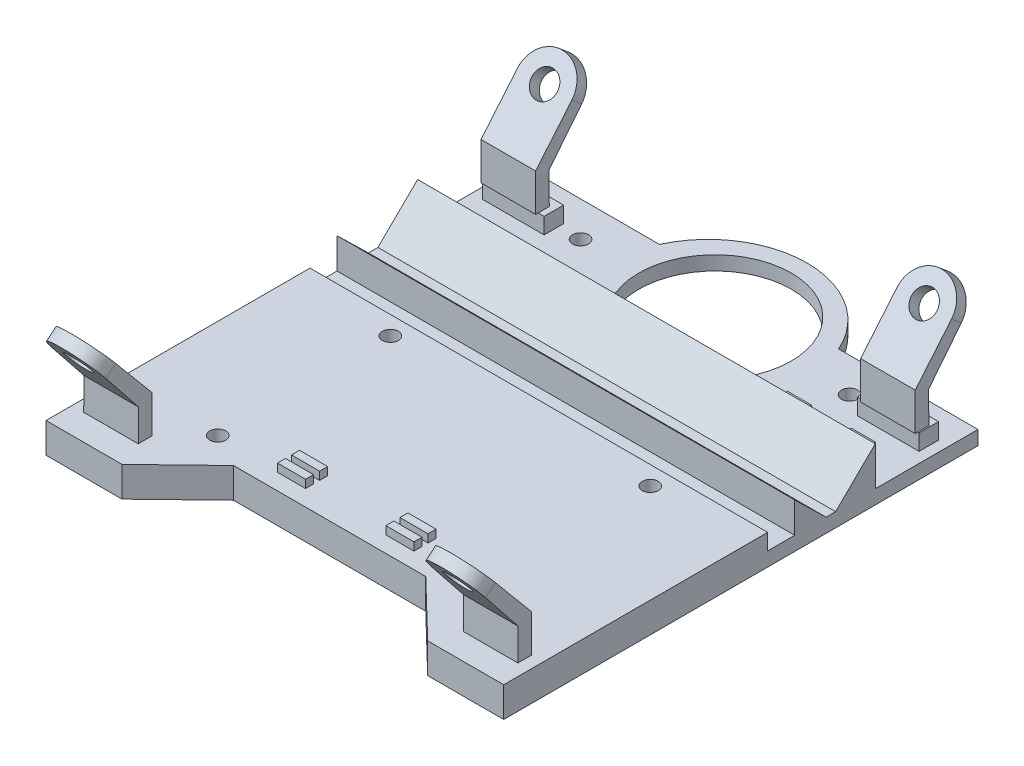
from build123d import *

# Parameters (mm, degrees)
SKIZZE1_W                        = 57
SKIZZE1_H                        = 60
AUFSATZ_LINEAR_AUSTRAGEN1_DEPTH  = 1.75
SKIZZE3_R                        = 9.495370676
SCHNITT_LINEAR_AUSTRAGEN1_DEPTH  = 2
SKIZZE4_W                        = 57
SKIZZE4_H                        = 26.054547174
AUFSATZ_LINEAR_AUSTRAGEN2_DEPTH  = 2
SKIZZE5_R                        = 1
SCHNITT_LINEAR_AUSTRAGEN2_DEPTH  = 4
AUFSATZ_LINEAR_AUSTRAGEN3_DEPTH  = 57
SKIZZE10_R                       = 1
SCHNITT_LINEAR_AUSTRAGEN3_DEPTH  = 2
AUFSATZ_LINEAR_AUSTRAGEN4_DEPTH  = 57
SKIZZE13_W                       = 3
SKIZZE13_H                       = 1
AUFSATZ_LINEAR_AUSTRAGEN6_DEPTH  = 1
SKIZZE16_W                       = 3.5
SKIZZE16_H                       = 1
AUFSATZ_LINEAR_AUSTRAGEN9_DEPTH  = 1
AUFSATZ_LINEAR_AUSTRAGEN11_DEPTH = 3.75
SKIZZE25_W                       = 6.8
SKIZZE25_H                       = 4.678014598
AUFSATZ_LINEAR_AUSTRAGEN12_DEPTH = 13
SKIZZE26_W                       = 6.272143652
SKIZZE26_H                       = 7.131924913
AUFSATZ_LINEAR_AUSTRAGEN13_DEPTH = 6.8
SCHNITT_LINEAR_AUSTRAGEN5_DEPTH  = 6.8
SCHNITT_LINEAR_AUSTRAGEN6_DEPTH  = 6.8
SCHNITT_LINEAR_AUSTRAGEN8_DEPTH  = 3.8
SKIZZE30_R                       = 1.6
SCHNITT_LINEAR_AUSTRAGEN9_DEPTH  = 3.8
SKIZZE31_W                       = 7.69751232
SKIZZE31_H                       = 2.429513609
AUFSATZ_LINEAR_AUSTRAGEN15_DEPTH = 2
SPIEGELN9_COPY_1_SKETCH_W        = 6.8
SPIEGELN9_COPY_1_SKETCH_H        = 4.678014598
SPIEGELN9_COPY_1_DEPTH           = 13
SPIEGELN9_COPY_2_SKETCH_W        = 6.272143652
SPIEGELN9_COPY_2_SKETCH_H        = 7.131924913
SPIEGELN9_COPY_2_DEPTH           = 6.8
SPIEGELN9_COPY_3_DEPTH           = 6.8
SPIEGELN9_COPY_4_DEPTH           = 6.8
SPIEGELN9_COPY_5_DEPTH           = 3.8
SPIEGELN9_COPY_6_SKETCH_R        = 1.6
SPIEGELN9_COPY_6_DEPTH           = 3.8
SCHNITT_LINEAR_AUSTRAGEN10_DEPTH = 10
SCHNITT_LINEAR_AUSTRAGEN11_DEPTH = 10


with BuildPart() as part:
    # Skizze1 → Aufsatz-Linear austragen1 (new body)
    with BuildSketch(Plane(origin=(0, 0, 0), x_dir=(1, 0, 0), z_dir=(0, 1, 0))):
        with Locations((28.5, 30)):
            Rectangle(SKIZZE1_W, SKIZZE1_H)
    extrude(amount=-AUFSATZ_LINEAR_AUSTRAGEN1_DEPTH)

    # Skizze3 → Schnitt-Linear austragen1 (cut)
    with BuildSketch(Plane(origin=(0, 0, 0), x_dir=(1, 0, 0), z_dir=(0, 1, 0))):
        with Locations(Location((28.5, 48, 0), (0, 0, 270))):
            Circle(SKIZZE3_R)
    extrude(amount=-SCHNITT_LINEAR_AUSTRAGEN1_DEPTH, mode=Mode.SUBTRACT)

    # Skizze4 → Aufsatz-Linear austragen2 (add)
    with BuildSketch(Plane(origin=(0, 0, 0), x_dir=(1, 0, 0), z_dir=(0, 1, 0))):
        with Locations((28.5, 13.027273587)):
            Rectangle(SKIZZE4_W, SKIZZE4_H)
    extrude(amount=AUFSATZ_LINEAR_AUSTRAGEN2_DEPTH)

    # Skizze5 → Schnitt-Linear austragen2 (cut)
    with BuildSketch(Plane(origin=(0, 2, 0), x_dir=(1, 0, 0), z_dir=(0, 1, 0))):
        with Locations(Location((12.315263515, 23.744868689, 0), (0, 0, 270))):
            Circle(SKIZZE5_R)
        with Locations(Location((12.315263515, 2.244868689, 0), (0, 0, 270))):
            Circle(SKIZZE5_R)
    schnitt_linear_austragen2 = extrude(amount=-SCHNITT_LINEAR_AUSTRAGEN2_DEPTH, mode=Mode.SUBTRACT)

    # Spiegeln1: Schnitt-Linear austragen2 across plane
    add(schnitt_linear_austragen2.mirror(Plane.ZY.offset(-28.5)), mode=Mode.SUBTRACT)

    # Skizze8 → Aufsatz-Linear austragen3 (add)
    with BuildSketch(Plane.ZY):
        Polygon((-29.419890543, 3.815337259), (-33.325270164, 0), (-29.419890543, 0), align=None)
    extrude(amount=-AUFSATZ_LINEAR_AUSTRAGEN3_DEPTH)

    # Skizze10 → Schnitt-Linear austragen3 (cut)
    with BuildSketch(Plane(origin=(0, 0, 0), x_dir=(1, 0, 0), z_dir=(0, 1, 0))):
        with Locations(Location((45.25, 48, 0), (0, 0, 270))):
            Circle(SKIZZE10_R)
        with Locations(Location((11.75, 48, 0), (0, 0, 270))):
            Circle(SKIZZE10_R)
    extrude(amount=-SCHNITT_LINEAR_AUSTRAGEN3_DEPTH, mode=Mode.SUBTRACT)

    # Skizze11 → Aufsatz-Linear austragen4 (add)
    with BuildSketch(Plane.ZY):
        Polygon((-39.458282478, 4.85029471), (-39.458282478, 0), (-34.51169532, 0), align=None)
    extrude(amount=-AUFSATZ_LINEAR_AUSTRAGEN4_DEPTH)

    # Skizze13 → Aufsatz-Linear austragen6 (add)
    with BuildSketch(Plane(origin=(0, 0, 0), x_dir=(1, 0, 0), z_dir=(0, 1, 0))):
        with Locations((51.5, 43)):
            Rectangle(SKIZZE13_W, SKIZZE13_H)
        with Locations((43.5, 43)):
            Rectangle(SKIZZE13_W, SKIZZE13_H)
        with Locations((51.5, 41.25)):
            Rectangle(SKIZZE13_W, SKIZZE13_H)
        with Locations((43.5, 41.25)):
            Rectangle(SKIZZE13_W, SKIZZE13_H)
    extrude(amount=AUFSATZ_LINEAR_AUSTRAGEN6_DEPTH)

    # Skizze16 → Aufsatz-Linear austragen9 (add)
    with BuildSketch(Plane(origin=(0, 2, 0), x_dir=(1, 0, 0), z_dir=(0, 1, 0))):
        with Locations((21.75, 2.5)):
            Rectangle(SKIZZE16_W, SKIZZE16_H)
        with Locations((35.25, 2.5)):
            Rectangle(SKIZZE16_W, SKIZZE16_H)
        with Locations((21.75, 4.25)):
            Rectangle(SKIZZE16_W, SKIZZE16_H)
        with Locations((35.25, 4.25)):
            Rectangle(SKIZZE16_W, SKIZZE16_H)
    extrude(amount=AUFSATZ_LINEAR_AUSTRAGEN9_DEPTH)

    # Skizze24 → Aufsatz-Linear austragen11 (add)
    with BuildSketch(Plane(origin=(0, 2, 0), x_dir=(1, 0, 0), z_dir=(0, 1, 0))):
        Polygon((57, 0), (57, -15.963189927), (46.470395694, -5.79521838), (40.469065327, 0), align=None)
    aufsatz_linear_austragen11 = extrude(amount=-AUFSATZ_LINEAR_AUSTRAGEN11_DEPTH)

    # Spiegeln2: Aufsatz-Linear austragen11 across plane
    add(aufsatz_linear_austragen11.mirror(Plane.ZY.offset(-28.5)))

    # Skizze25 → Aufsatz-Linear austragen12 (add)
    with BuildSketch(Plane(origin=(0, 2, 0), x_dir=(1, 0, 0), z_dir=(0, 1, 0))):
        with Locations((52.135864274, -3.62433538)):
            Rectangle(SKIZZE25_W, SKIZZE25_H)
    aufsatz_linear_austragen12 = extrude(amount=AUFSATZ_LINEAR_AUSTRAGEN12_DEPTH)

    # Skizze26 → Aufsatz-Linear austragen13 (add)
    with BuildSketch(Plane(origin=(55.535864274, 0, 0), x_dir=(0, 0, -1), z_dir=(1, 0, 0))):
        with Locations((-9.099414505, 11.434037544)):
            Rectangle(SKIZZE26_W, SKIZZE26_H)
    aufsatz_linear_austragen13 = extrude(amount=-AUFSATZ_LINEAR_AUSTRAGEN13_DEPTH)

    # Skizze27 → Schnitt-Linear austragen5 (cut)
    with BuildSketch(Plane(origin=(55.535864274, 0, 0), x_dir=(0, 0, -1), z_dir=(1, 0, 0))):
        Polygon((-10.768511785, 15), (-3.552210741, 5.947030188), (-3.590728104, 2), (-6.081048451, 2), (-5.963342679, 7.868075087), (-12.235486331, 7.868075087), (-12.235486331, 15), align=None)
    schnitt_linear_austragen5 = extrude(amount=-SCHNITT_LINEAR_AUSTRAGEN5_DEPTH, mode=Mode.SUBTRACT)

    # Skizze28 → Schnitt-Linear austragen6 (cut)
    with BuildSketch(Plane(origin=(55.535864274, 0, 0), x_dir=(0, 0, -1), z_dir=(1, 0, 0))):
        Polygon((-9.855196272, 13.854230483), (-8.675818052, 14.794336156), (-1.891775147, 6.686320141), (-1.891775147, 2), (-1.241465065, 2), (-1.241465065, 15.430103774), (-11.112831421, 15.430103774), align=None)
    schnitt_linear_austragen6 = extrude(amount=-SCHNITT_LINEAR_AUSTRAGEN6_DEPTH, mode=Mode.SUBTRACT)

    # Skizze29 → Schnitt-Linear austragen8 (cut)
    with BuildSketch(Plane(origin=(0, 1.822324688, -2.177969385), x_dir=(-1, 0, 0), z_dir=(0, 0.6417106486161895, -0.7669468322201934))):
        with BuildLine():
            Line((-55.535864274, 13.383825147), (-55.535864274, 17.083825147))
            Line((-55.535864274, 17.083825147), (-48.735864274, 17.083825147))
            Line((-48.735864274, 17.083825147), (-48.735864274, 13.383825147))
            ThreePointArc((-48.735864274, 13.383825147), (-52.135864274, 16.783825147), (-55.535864274, 13.383825147))
        make_face()
    schnitt_linear_austragen8 = extrude(amount=-SCHNITT_LINEAR_AUSTRAGEN8_DEPTH, mode=Mode.SUBTRACT)

    # Skizze30 → Schnitt-Linear austragen9 (cut)
    with BuildSketch(Plane(origin=(0, 1.822324688, -2.177969385), x_dir=(-1, 0, 0), z_dir=(0, 0.6417106486161896, -0.7669468322201933))):
        with Locations(Location((-52.135864274, 13.383825147, 0), (0, 0, 90))):
            Circle(SKIZZE30_R)
    schnitt_linear_austragen9 = extrude(amount=-SCHNITT_LINEAR_AUSTRAGEN9_DEPTH, mode=Mode.SUBTRACT)

    # Spiegeln6: Aufsatz-Linear austragen12, Aufsatz-Linear austragen13, Schnitt-Linear austragen5, Schnitt-Linear austragen6, Schnitt-Linear austragen8, Schnitt-Linear austragen9 across plane
    add(aufsatz_linear_austragen12.mirror(Plane.ZY.offset(-28.5)))
    add(aufsatz_linear_austragen13.mirror(Plane.ZY.offset(-28.5)))
    add(schnitt_linear_austragen5.mirror(Plane.ZY.offset(-28.5)), mode=Mode.SUBTRACT)
    add(schnitt_linear_austragen6.mirror(Plane.ZY.offset(-28.5)), mode=Mode.SUBTRACT)
    add(schnitt_linear_austragen8.mirror(Plane.ZY.offset(-28.5)), mode=Mode.SUBTRACT)
    add(schnitt_linear_austragen9.mirror(Plane.ZY.offset(-28.5)), mode=Mode.SUBTRACT)

    # Skizze31 → Aufsatz-Linear austragen15 (add)
    with BuildSketch(Plane(origin=(0, 0, 0), x_dir=(1, 0, 0), z_dir=(0, 1, 0))):
        with Locations((51.84875616, 47.423389314)):
            Rectangle(SKIZZE31_W, SKIZZE31_H)
    aufsatz_linear_austragen15 = extrude(amount=AUFSATZ_LINEAR_AUSTRAGEN15_DEPTH)

    # Spiegeln8: Aufsatz-Linear austragen12, Aufsatz-Linear austragen13, Schnitt-Linear austragen5, Schnitt-Linear austragen6, Schnitt-Linear austragen8, Schnitt-Linear austragen9 across plane
    add(aufsatz_linear_austragen12.mirror(Plane(origin=(0, 0, -22), x_dir=(1, 0, 0), z_dir=(0, 0, -1))))
    add(aufsatz_linear_austragen13.mirror(Plane(origin=(0, 0, -22), x_dir=(1, 0, 0), z_dir=(0, 0, -1))))
    add(schnitt_linear_austragen5.mirror(Plane(origin=(0, 0, -22), x_dir=(1, 0, 0), z_dir=(0, 0, -1))), mode=Mode.SUBTRACT)
    add(schnitt_linear_austragen6.mirror(Plane(origin=(0, 0, -22), x_dir=(1, 0, 0), z_dir=(0, 0, -1))), mode=Mode.SUBTRACT)
    add(schnitt_linear_austragen8.mirror(Plane(origin=(0, 0, -22), x_dir=(1, 0, 0), z_dir=(0, 0, -1))), mode=Mode.SUBTRACT)
    add(schnitt_linear_austragen9.mirror(Plane(origin=(0, 0, -22), x_dir=(1, 0, 0), z_dir=(0, 0, -1))), mode=Mode.SUBTRACT)

    # Spiegeln9: Aufsatz-Linear austragen12, Schnitt-Linear austragen5, Schnitt-Linear austragen6, Schnitt-Linear austragen8, Schnitt-Linear austragen9, Aufsatz-Linear austragen15 across plane
    add(aufsatz_linear_austragen12.mirror(Plane.ZY.offset(-28.5)))
    add(schnitt_linear_austragen5.mirror(Plane.ZY.offset(-28.5)), mode=Mode.SUBTRACT)
    add(schnitt_linear_austragen6.mirror(Plane.ZY.offset(-28.5)), mode=Mode.SUBTRACT)
    add(schnitt_linear_austragen8.mirror(Plane.ZY.offset(-28.5)), mode=Mode.SUBTRACT)
    add(schnitt_linear_austragen9.mirror(Plane.ZY.offset(-28.5)), mode=Mode.SUBTRACT)
    add(aufsatz_linear_austragen15.mirror(Plane.ZY.offset(-28.5)))

    # Spiegeln9 copy 1 sketch → Spiegeln9 copy 1 (add)
    with BuildSketch(Plane(origin=(57, 2, -44), x_dir=(-1, 0, 0), z_dir=(0, 1, 0))):
        with Locations((52.135864274, -3.62433538)):
            Rectangle(SPIEGELN9_COPY_1_SKETCH_W, SPIEGELN9_COPY_1_SKETCH_H)
    extrude(amount=SPIEGELN9_COPY_1_DEPTH)

    # Spiegeln9 copy 2 sketch → Spiegeln9 copy 2 (add)
    with BuildSketch(Plane(origin=(1.464135726, 0, -44), x_dir=(0, 0, 1), z_dir=(-1, 0, 0))):
        with Locations((-9.099414505, 11.434037544)):
            Rectangle(SPIEGELN9_COPY_2_SKETCH_W, SPIEGELN9_COPY_2_SKETCH_H)
    extrude(amount=-SPIEGELN9_COPY_2_DEPTH)

    # Spiegeln9 copy 3 sketch → Spiegeln9 copy 3 (cut)
    with BuildSketch(Plane(origin=(1.464135726, 0, -44), x_dir=(0, 0, 1), z_dir=(-1, 0, 0))):
        Polygon((-10.768511785, 15), (-3.552210741, 5.947030188), (-3.590728104, 2), (-6.081048451, 2), (-5.963342679, 7.868075087), (-12.235486331, 7.868075087), (-12.235486331, 15), align=None)
    extrude(amount=-SPIEGELN9_COPY_3_DEPTH, mode=Mode.SUBTRACT)

    # Spiegeln9 copy 4 sketch → Spiegeln9 copy 4 (cut)
    with BuildSketch(Plane(origin=(1.464135726, 0, -44), x_dir=(0, 0, 1), z_dir=(-1, 0, 0))):
        Polygon((-9.855196272, 13.854230483), (-8.675818052, 14.794336156), (-1.891775147, 6.686320141), (-1.891775147, 2), (-1.241465065, 2), (-1.241465065, 15.430103774), (-11.112831421, 15.430103774), align=None)
    extrude(amount=-SPIEGELN9_COPY_4_DEPTH, mode=Mode.SUBTRACT)

    # Spiegeln9 copy 5 sketch → Spiegeln9 copy 5 (cut)
    with BuildSketch(Plane(origin=(57, 1.822324688, -41.822030615), x_dir=(1, 0, 0), z_dir=(0, 0.6417106486161895, 0.7669468322201934))):
        with BuildLine():
            Line((-55.535864274, 13.383825147), (-55.535864274, 17.083825147))
            Line((-55.535864274, 17.083825147), (-48.735864274, 17.083825147))
            Line((-48.735864274, 17.083825147), (-48.735864274, 13.383825147))
            ThreePointArc((-48.735864274, 13.383825147), (-52.135864274, 16.783825147), (-55.535864274, 13.383825147))
        make_face()
    extrude(amount=-SPIEGELN9_COPY_5_DEPTH, mode=Mode.SUBTRACT)

    # Spiegeln9 copy 6 sketch → Spiegeln9 copy 6 (cut)
    with BuildSketch(Plane(origin=(57, 1.822324688, -41.822030615), x_dir=(1, 0, 0), z_dir=(0, 0.6417106486161896, 0.7669468322201933))):
        with Locations(Location((-52.135864274, 13.383825147, 0), (0, 0, 90))):
            Circle(SPIEGELN9_COPY_6_SKETCH_R)
    extrude(amount=-SPIEGELN9_COPY_6_DEPTH, mode=Mode.SUBTRACT)

    # Skizze36 → Schnitt-Linear austragen10 (cut)
    with BuildSketch(Plane(origin=(0, 0, 0), x_dir=(1, 0, 0), z_dir=(0, 1, 0))):
        with BuildLine():
            Line((0, 52.369033875), (17.208372804, 52.369033875))
            ThreePointArc((17.208372804, 52.369033875), (28.464546382, 59.557465407), (39.640881486, 52.2455214))
            Line((39.640881486, 52.2455214), (57, 52.2455214))
            Line((57, 52.2455214), (57, 60))
            Line((57, 60), (0, 60))
            Line((0, 60), (0, 52.369033875))
        make_face()
    extrude(amount=-SCHNITT_LINEAR_AUSTRAGEN10_DEPTH, mode=Mode.SUBTRACT)

    # Skizze37 → Schnitt-Linear austragen11 (cut)
    with BuildSketch(Plane(origin=(0, 2, 0), x_dir=(1, 0, 0), z_dir=(0, 1, 0))):
        Polygon((0, -6.821439936), (9.576067719, -6.821439936), (0, -15.963189927), align=None)
    schnitt_linear_austragen11 = extrude(amount=-SCHNITT_LINEAR_AUSTRAGEN11_DEPTH, mode=Mode.SUBTRACT)

    # Spiegeln10: Schnitt-Linear austragen11 across plane
    add(schnitt_linear_austragen11.mirror(Plane.ZY.offset(-28.5)), mode=Mode.SUBTRACT)


solid = part.part
